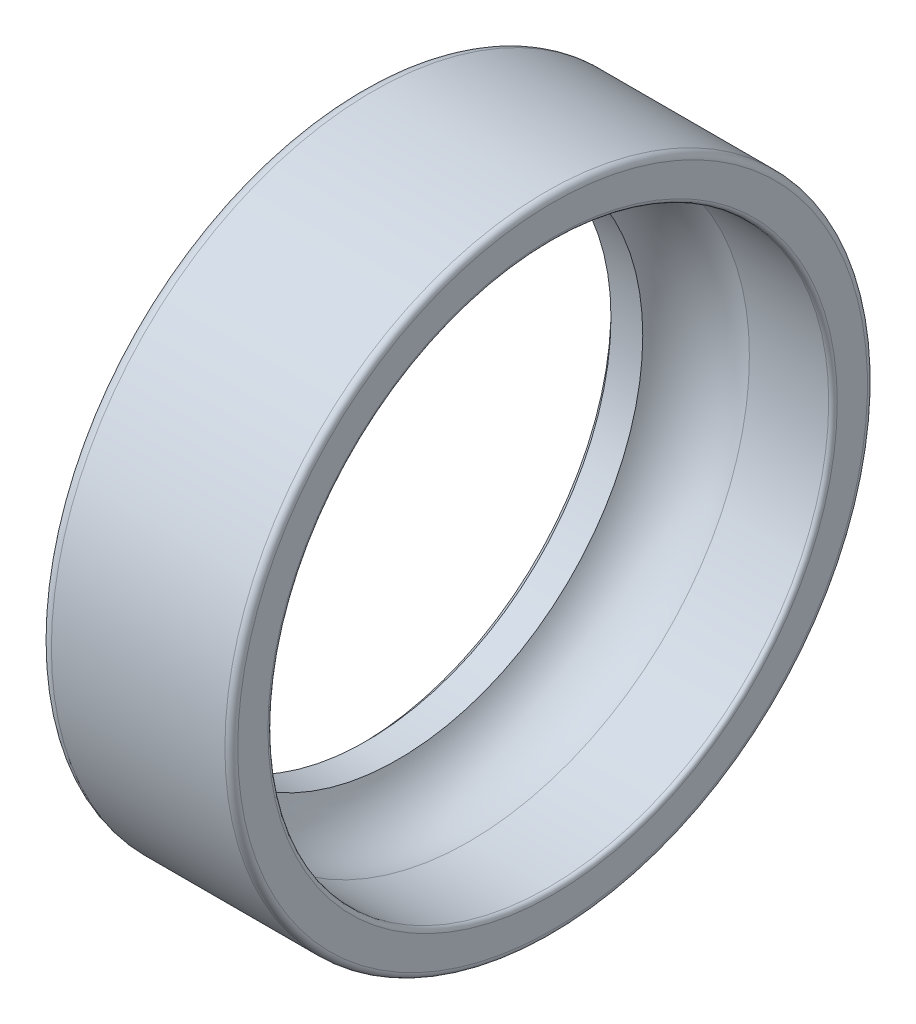
from build123d import *


with BuildPart() as part:
    # Sketch1 → Revolve1 (revolve)
    with BuildSketch(Plane.XY, mode=Mode.PRIVATE) as revolve1_sk:
        with BuildLine():
            Line((0, 11.725), (0.3, 11.425))
            Line((0.3, 11.425), (1.784419951, 11.425))
            ThreePointArc((1.784419951, 11.425), (3.152721413, 12.830455262), (5.096992462, 13.09))
            Line((5.096992462, 13.09), (8.8, 13.09))
            ThreePointArc((8.8, 13.09), (8.941421356, 13.148578644), (9, 13.29))
            Line((9, 13.29), (9, 14.7))
            ThreePointArc((9, 14.7), (8.912132034, 14.912132034), (8.7, 15))
            Line((8.7, 15), (0.6, 15))
            ThreePointArc((0.6, 15), (0.175735931, 14.824264069), (0, 14.4))
            Line((0, 14.4), (0, 11.725))
        make_face()
    revolve(revolve1_sk.sketch.rotate(Axis((9, 0, 0), (-1, 0, 0)), 270), axis=Axis((9, 0, 0), (-1, 0, 0)))


solid = part.part
